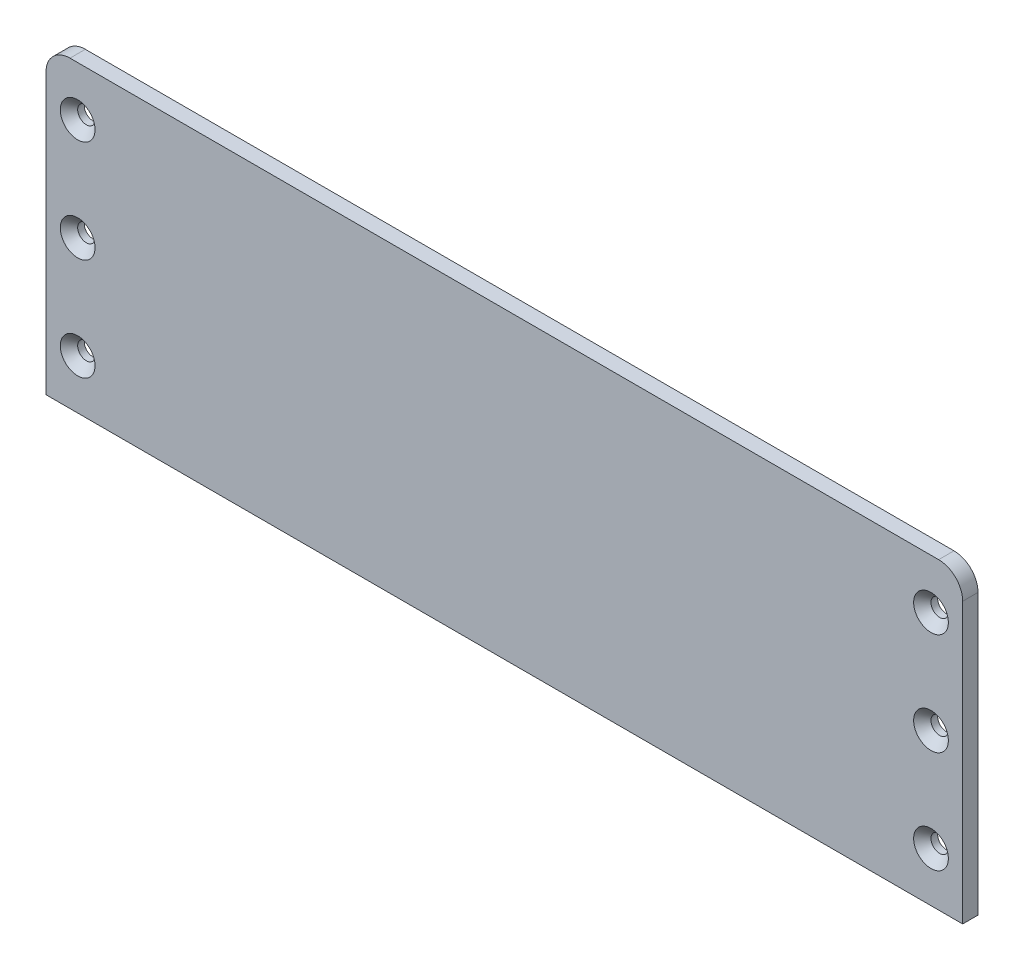
from build123d import *

# Parameters (mm, degrees)
SKETCH1_W                                      = 180
SKETCH1_H                                      = 60
BOSS_EXTRUDE1_DEPTH                            = 3
FILLET1_R                                      = 5
CSK_FOR_M3_FLAT_HEAD_MACHINE_SCREW1_AT_2_COUNT = 2
CSK_FOR_M3_FLAT_HEAD_MACHINE_SCREW1_AT_2_PITCH = 20
CSK_FOR_M3_FLAT_HEAD_MACHINE_SCREW1_AT_3_COUNT = 2
CSK_FOR_M3_FLAT_HEAD_MACHINE_SCREW1_AT_3_PITCH = 40
CSK_FOR_M3_FLAT_HEAD_MACHINE_SCREW1_AT_4_COUNT = 2
CSK_FOR_M3_FLAT_HEAD_MACHINE_SCREW1_AT_4_PITCH = 167
CSK_FOR_M3_FLAT_HEAD_MACHINE_SCREW1_AT_5_COUNT = 2
CSK_FOR_M3_FLAT_HEAD_MACHINE_SCREW1_AT_5_PITCH = 168.193341129
CSK_FOR_M3_FLAT_HEAD_MACHINE_SCREW1_AT_6_COUNT = 2
CSK_FOR_M3_FLAT_HEAD_MACHINE_SCREW1_AT_6_PITCH = 171.723615149
CUT_EXTRUDE1_REACH                             = 96.916


with BuildPart() as part:
    # Sketch1 → Boss-Extrude1 (new body)
    with BuildSketch(Plane.XY):
        Rectangle(SKETCH1_W, SKETCH1_H)
    extrude(amount=BOSS_EXTRUDE1_DEPTH)

    # Fillet1
    fillet1_edges = [part.edges().sort_by_distance(p)[0] for p in [
        (-90, 30, 1.5),
        (90, 30, 1.5),
    ]]
    fillet(fillet1_edges, radius=FILLET1_R)

    # Sketch3 → CSK for M3 Flat Head Machine Screw1 (revolve, cut)
    with BuildSketch(Plane(origin=(-83.5, 20, 3), x_dir=(0, -1, 0), z_dir=(1, 0, 0))):
        Polygon((0, 0), (0, 3), (1.7, 3), (1.7, 1.7), (3.4, 0), align=None)
    csk_for_m3_flat_head_machine_screw1 = revolve(axis=Axis((-83.5, 20, 9.35), (0, 0, -1)), mode=Mode.SUBTRACT)

    # CSK for M3 Flat Head Machine Screw1 at 2: CSK for M3 Flat Head Machine Screw1 ×2
    with Locations(*[(0, -i * CSK_FOR_M3_FLAT_HEAD_MACHINE_SCREW1_AT_2_PITCH, 0) for i in range(1, CSK_FOR_M3_FLAT_HEAD_MACHINE_SCREW1_AT_2_COUNT)]):
        add(csk_for_m3_flat_head_machine_screw1, mode=Mode.SUBTRACT)

    # CSK for M3 Flat Head Machine Screw1 at 3: CSK for M3 Flat Head Machine Screw1 ×2
    with Locations(*[(0, -i * CSK_FOR_M3_FLAT_HEAD_MACHINE_SCREW1_AT_3_PITCH, 0) for i in range(1, CSK_FOR_M3_FLAT_HEAD_MACHINE_SCREW1_AT_3_COUNT)]):
        add(csk_for_m3_flat_head_machine_screw1, mode=Mode.SUBTRACT)

    # CSK for M3 Flat Head Machine Screw1 at 4: CSK for M3 Flat Head Machine Screw1 ×2
    with Locations(*[(i * CSK_FOR_M3_FLAT_HEAD_MACHINE_SCREW1_AT_4_PITCH, 0, 0) for i in range(1, CSK_FOR_M3_FLAT_HEAD_MACHINE_SCREW1_AT_4_COUNT)]):
        add(csk_for_m3_flat_head_machine_screw1, mode=Mode.SUBTRACT)

    # CSK for M3 Flat Head Machine Screw1 at 5: CSK for M3 Flat Head Machine Screw1 ×2
    with Locations(*[Vector(0.9929049442707555, -0.11891077176895277, 0) * (i * CSK_FOR_M3_FLAT_HEAD_MACHINE_SCREW1_AT_5_PITCH) for i in range(1, CSK_FOR_M3_FLAT_HEAD_MACHINE_SCREW1_AT_5_COUNT)]):
        add(csk_for_m3_flat_head_machine_screw1, mode=Mode.SUBTRACT)

    # CSK for M3 Flat Head Machine Screw1 at 6: CSK for M3 Flat Head Machine Screw1 ×2
    with Locations(*[Vector(0.9724929204096406, -0.2329324360262613, 0) * (i * CSK_FOR_M3_FLAT_HEAD_MACHINE_SCREW1_AT_6_PITCH) for i in range(1, CSK_FOR_M3_FLAT_HEAD_MACHINE_SCREW1_AT_6_COUNT)]):
        add(csk_for_m3_flat_head_machine_screw1, mode=Mode.SUBTRACT)

    # Sketch4 → Cut-Extrude1 (cut, up to next)
    with BuildSketch(Plane.XY.offset(3), mode=Mode.PRIVATE) as cut_extrude1_sk1:
        with BuildLine():
            Line((85, 30), (-85, 30))
            ThreePointArc((-85, 30), (-88.535533906, 28.535533906), (-90, 25))
            Line((-90, 25), (-90, -30))
            Line((-90, -30), (90, -30))
            Line((90, -30), (90, 25))
            ThreePointArc((90, 25), (88.535533906, 28.535533906), (85, 30))
        make_face()
        with BuildLine():
            Line((85, 29.7), (-85, 29.7))
            ThreePointArc((-85, 29.7), (-88.323401872, 28.323401872), (-89.7, 25))
            Line((-89.7, 25), (-89.7, -29.7))
            Line((-89.7, -29.7), (89.7, -29.7))
            Line((89.7, -29.7), (89.7, 25))
            ThreePointArc((89.7, 25), (88.323401872, 28.323401872), (85, 29.7))
        make_face(mode=Mode.SUBTRACT)
    cut_extrude1_tool1 = extrude(cut_extrude1_sk1.sketch, amount=-CUT_EXTRUDE1_REACH, mode=Mode.PRIVATE) & part.part
    add(cut_extrude1_tool1.solids().sort_by_distance((0, 29.810263, 3))[0], mode=Mode.SUBTRACT)


solid = part.part
